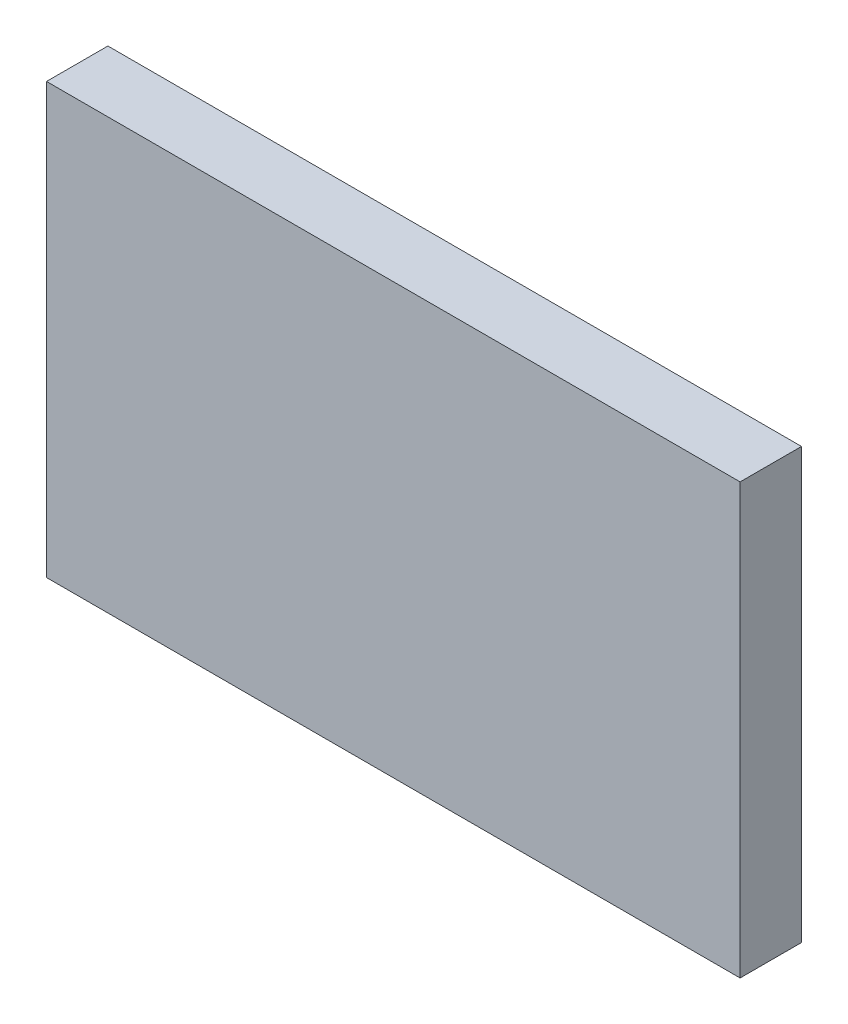
from build123d import *

# Parameters (mm, degrees)
SKETCH1_W           = 71.755
SKETCH1_H           = 44.45
BOSS_EXTRUDE1_DEPTH = 3.175


with BuildPart() as part:
    # Sketch1 → Boss-Extrude1 (new, symmetric)
    with BuildSketch(Plane.XY):
        with Locations((0, 22.225)):
            Rectangle(SKETCH1_W, SKETCH1_H)
    extrude(amount=BOSS_EXTRUDE1_DEPTH, both=True)


solid = part.part
